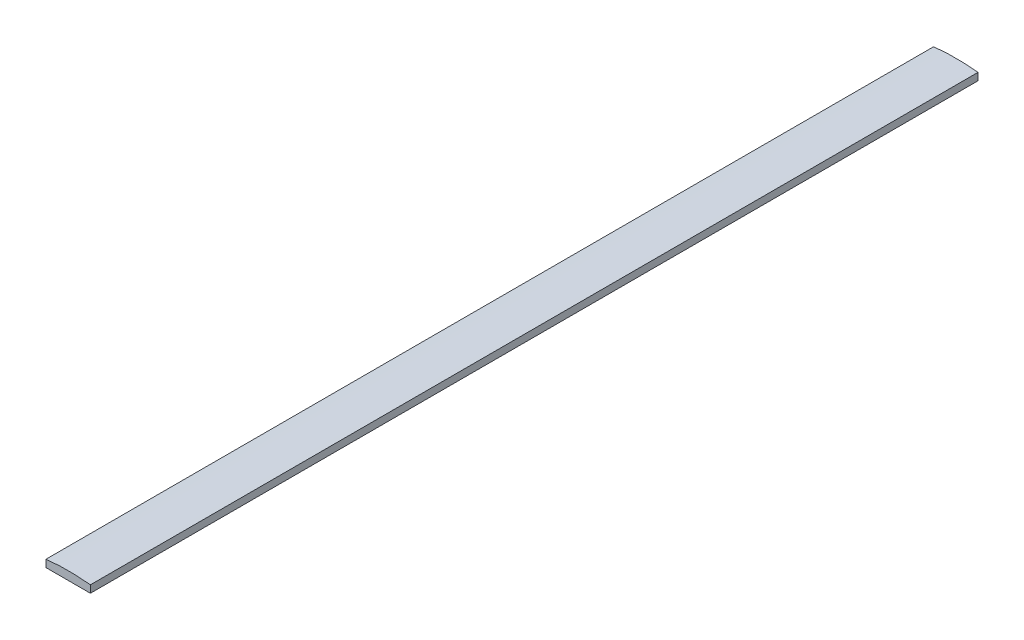
from build123d import *

# Parameters (mm, degrees)
AUFSATZ_LINEAR_AUSTRAGEN1_DEPTH = 330


with BuildPart() as part:
    # Skizze1 → Aufsatz-Linear austragen1 (new body)
    with BuildSketch(Plane.XY):
        with BuildLine():
            Line((-12.653617461, 5.083456237), (-12.653617461, 2.357456237))
            Line((-12.653617461, 2.357456237), (3.846382539, 2.357456237))
            Line((3.846382539, 2.357456237), (3.846382539, 5.083456237))
            ThreePointArc((3.846382539, 5.083456237), (-4.403617461, 5.532562794), (-12.653617461, 5.083456237))
        make_face()
    extrude(amount=AUFSATZ_LINEAR_AUSTRAGEN1_DEPTH)


solid = part.part
